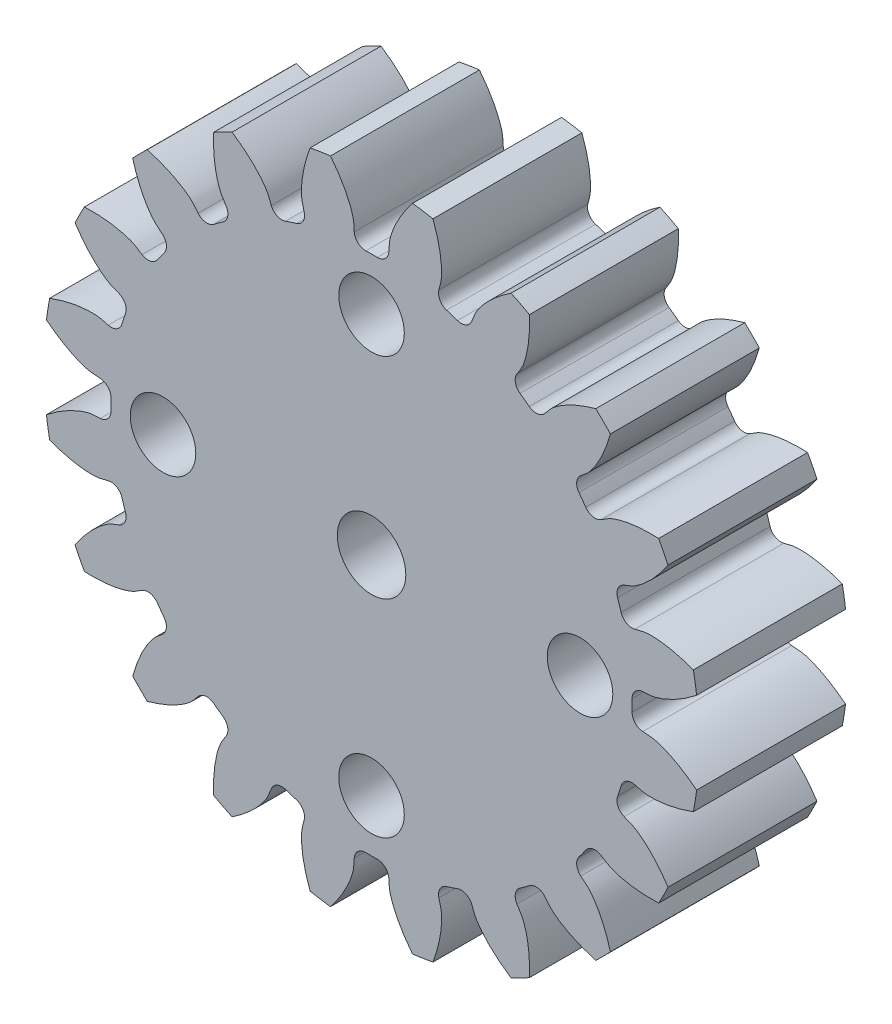
from build123d import *

# Parameters (mm, degrees)
SKETCH_1_R          = 11
LASHENA_DEPTH       = 5
CUT_EXTRUDEA_DEPTH  = 30
WWW_KYTOOL_CN_COUNT = 20
SKETCH_4_R          = 1.1
CUT_EXTRUDE_2_DEPTH = 17.223561845
SKETCH_5_R          = 4
CUT_EXTRUDE_3_DEPTH = 3
SKETCH_6_R          = 1.15
CUT_EXTRUDE_4_DEPTH = 3


with BuildPart() as part:
    # 草图1 → LaShenA (new body)
    with BuildSketch(Plane.XY):
        Circle(SKETCH_1_R)
    extrude(amount=LASHENA_DEPTH)

    # SketchA → Cut-ExtrudeA (cut)
    with BuildSketch(Plane.XY.offset(5)):
        with BuildLine():
            ThreePointArc((0.192666948, 8.747878568), (0, 8.75), (-0.192666948, 8.747878568))
            ThreePointArc((-0.192666948, 8.747878568), (-0.458280641, 8.848100421), (-0.58031545, 9.104425526))
            add(Edge.make_bspline(
                [(-0.58031545, 9.104425526), (-0.585965039, 9.196150672), (-0.588120625, 9.316290214), (-0.608029006, 9.448424481), (-0.620371848, 9.504258495), (-0.631259446, 9.548464019), (-0.645249714, 9.599097693), (-0.662644566, 9.656034313), (-0.68381525, 9.719115424), (-0.709102663, 9.788174084), (-0.738848954, 9.863027121), (-0.773386802, 9.943477892), (-0.813042089, 10.029315748), (-0.858132409, 10.120316542), (-0.908966875, 10.216242847), (-0.965845542, 10.316844278), (-1.029058956, 10.421857806), (-1.098887686, 10.531008098), (-1.175601869, 10.644007865), (-1.259460763, 10.760558232), (-1.350712351, 10.880349119), (-1.449592793, 11.003059648), (-1.594932378, 11.173679385), (-1.711600622, 11.299586697), (-1.79314737, 11.383098021)],
                knots=[0.125068197, 0.125068197, 0.125068197, 0.125068197, 0.215847125, 0.244833276, 0.257593391, 0.272673526, 0.290073681, 0.309793857, 0.331834054, 0.356194271, 0.382874509, 0.411874767, 0.443195046, 0.476835345, 0.512795666, 0.551076006, 0.591676368, 0.634596749, 0.679837152, 0.727397575, 0.777278019, 0.829478483, 0.883998968, 1, 1, 1, 1], degree=3))
            ThreePointArc((-1.79314737, 11.383098021), (0, 11.523467275), (1.79314737, 11.383098021))
            add(Edge.make_bspline(
                [(0.58031545, 9.104425526), (0.585965039, 9.196150672), (0.588120625, 9.316290214), (0.608029006, 9.448424481), (0.620371848, 9.504258495), (0.631259446, 9.548464019), (0.645249714, 9.599097693), (0.662644566, 9.656034313), (0.68381525, 9.719115424), (0.709102663, 9.788174084), (0.738848954, 9.863027121), (0.773386802, 9.943477892), (0.813042089, 10.029315748), (0.858132409, 10.120316542), (0.908966875, 10.216242847), (0.965845542, 10.316844278), (1.029058956, 10.421857806), (1.098887686, 10.531008098), (1.175601869, 10.644007865), (1.259460763, 10.760558232), (1.350712351, 10.880349119), (1.449592793, 11.003059648), (1.594932378, 11.173679385), (1.711600622, 11.299586697), (1.79314737, 11.383098021)],
                knots=[0.125068197, 0.125068197, 0.125068197, 0.125068197, 0.215847125, 0.244833276, 0.257593391, 0.272673526, 0.290073681, 0.309793857, 0.331834054, 0.356194271, 0.382874509, 0.411874767, 0.443195046, 0.476835345, 0.512795666, 0.551076006, 0.591676368, 0.634596749, 0.679837152, 0.727397575, 0.777278019, 0.829478483, 0.883998968, 1, 1, 1, 1], degree=3))
            ThreePointArc((0.58031545, 9.104425526), (0.458280641, 8.848100421), (0.192666948, 8.747878568))
        make_face()
    cut_extrudea = extrude(amount=-CUT_EXTRUDEA_DEPTH, mode=Mode.SUBTRACT)

    # www.KYTool.cn: Cut-ExtrudeA ×20 about axis
    www_kytool_cn_axis = Axis((0, 0, -88.99), (0, 0, 1))
    for i in range(1, WWW_KYTOOL_CN_COUNT):
        add(cut_extrudea.rotate(www_kytool_cn_axis, i * 360 / WWW_KYTOOL_CN_COUNT), mode=Mode.SUBTRACT)

    # 草图4 → 切除-拉伸2 (cut, through all)
    with BuildSketch(Plane.XY.offset(5)):
        with Locations((7, 0)):
            Circle(SKETCH_4_R)
        with Locations((0, -7)):
            Circle(SKETCH_4_R)
        with Locations((-7, 0)):
            Circle(SKETCH_4_R)
        with Locations((0, 7)):
            Circle(SKETCH_4_R)
    extrude(amount=-CUT_EXTRUDE_2_DEPTH, mode=Mode.SUBTRACT)

    # 草图5 → 切除-拉伸3 (cut)
    with BuildSketch(Plane(origin=(0, 0, 0), x_dir=(-1, 0, 0), z_dir=(0, 0, -1))):
        Circle(SKETCH_5_R)
    extrude(amount=-CUT_EXTRUDE_3_DEPTH, mode=Mode.SUBTRACT)

    # 草图6 → 切除-拉伸4 (cut)
    with BuildSketch(Plane(origin=(0, 0, 3), x_dir=(-1, 0, 0), z_dir=(0, 0, -1))):
        Circle(SKETCH_6_R)
    extrude(amount=-CUT_EXTRUDE_4_DEPTH, mode=Mode.SUBTRACT)


solid = part.part
